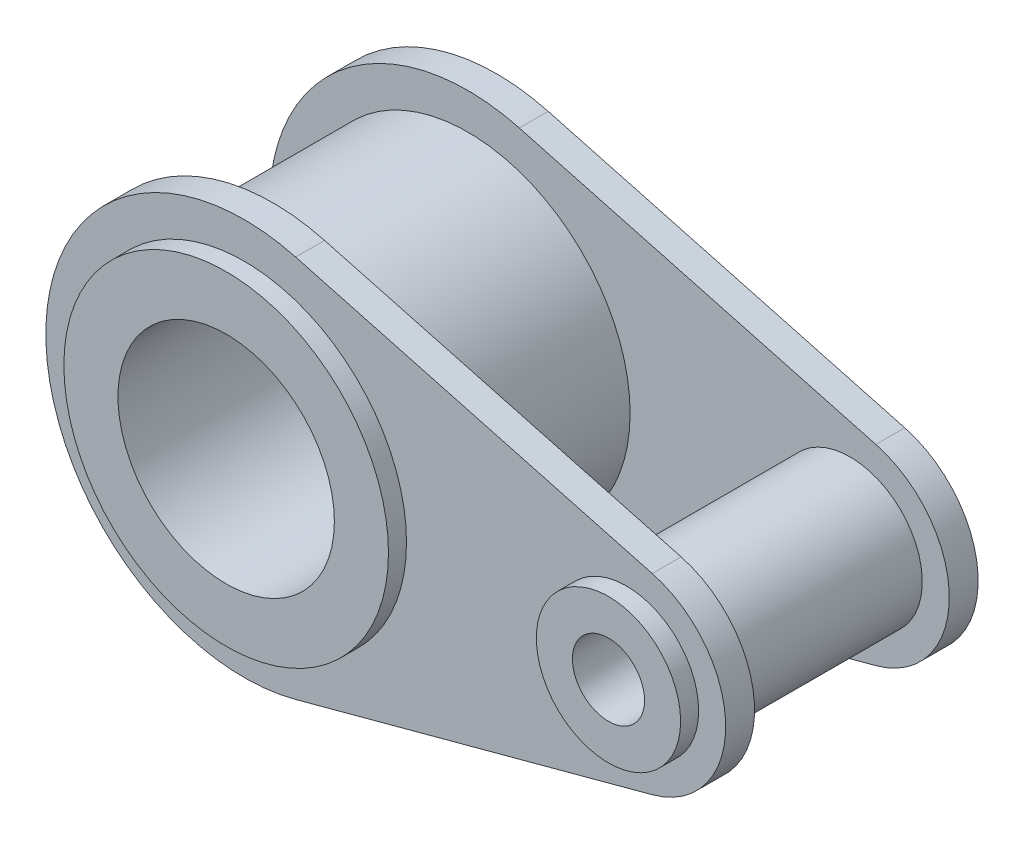
from build123d import *

# Parameters (mm, degrees)
SKETCH_1_R        = 45
SKETCH_1_R_2      = 30
EXTRUDE_5_DEPTH   = 40
SKETCH_1_R_3      = 20
SKETCH_1_R_4      = 10
EXTRUDE_5_2_DEPTH = 40
EXTRUDE_START     = 35
SKETCH_1_7_R      = 45
SKETCH_1_7_R_2    = 20
EXTRUDE_6_DEPTH   = 8


with BuildPart() as part:
    # 草图1 → 凸台-拉伸5 (new, symmetric)
    with BuildSketch(Plane.XY):
        Circle(SKETCH_1_R)
        Circle(SKETCH_1_R_2, mode=Mode.SUBTRACT)
    extrude(amount=EXTRUDE_5_DEPTH, both=True)



with BuildPart() as body_2:
    # 草图1 → Extrude 5 2 (new, symmetric)
    with BuildSketch(Plane.XY):
        with Locations((106, 0)):
            Circle(SKETCH_1_R_3)
        with Locations((106, 0)):
            Circle(SKETCH_1_R_4, mode=Mode.SUBTRACT)
    extrude(amount=EXTRUDE_5_2_DEPTH, both=True)


with BuildPart() as part_1:
    add(part.part)

    add(body_2.part)  # 凸台-拉伸6 merges body 2
    # 草图1<7> → 凸台-拉伸6 (add)
    with BuildSketch(Plane.XY.offset(EXTRUDE_START)):
        with BuildLine():
            Line((113.134433962, 26.558423373), (14.268867925, 53.116846745))
            ThreePointArc((14.268867925, 53.116846745), (-55, 0), (14.268867925, -53.116846745))
            Line((14.268867925, -53.116846745), (113.134433962, -26.558423373))
            ThreePointArc((113.134433962, -26.558423373), (133.5, 0), (113.134433962, 26.558423373))
        make_face()
        Circle(SKETCH_1_7_R, mode=Mode.SUBTRACT)
        with Locations((106, 0)):
            Circle(SKETCH_1_7_R_2, mode=Mode.SUBTRACT)
    extrude_6 = extrude(amount=-EXTRUDE_6_DEPTH)

    # 镜向2: 凸台-拉伸6 across plane
    add(extrude_6.mirror(Plane.XY))


solid = part_1.part
